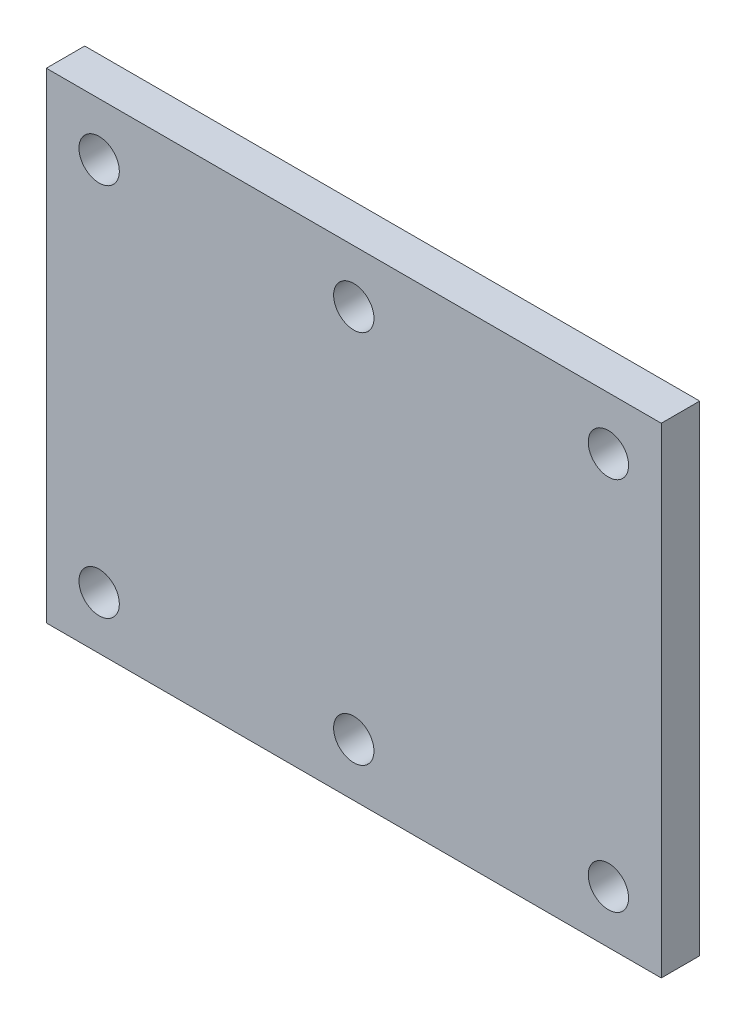
from build123d import *

# Parameters (mm, degrees)
SKETCH1_W           = 64
SKETCH1_H           = 50
SKETCH1_R           = 2.1
BOSS_EXTRUDE1_DEPTH = 4


with BuildPart() as part:
    # Sketch1 → Boss-Extrude1 (new body)
    with BuildSketch(Plane.XY):
        Rectangle(SKETCH1_W, SKETCH1_H)
        with Locations((-26.5, 19.5)):
            Circle(SKETCH1_R, mode=Mode.SUBTRACT)
        with Locations((26.5, 19.5)):
            Circle(SKETCH1_R, mode=Mode.SUBTRACT)
        with Locations((-26.5, -19.5)):
            Circle(SKETCH1_R, mode=Mode.SUBTRACT)
        with Locations((26.5, -19.5)):
            Circle(SKETCH1_R, mode=Mode.SUBTRACT)
        with Locations((0, 19.5)):
            Circle(SKETCH1_R, mode=Mode.SUBTRACT)
        with Locations((0, -19.5)):
            Circle(SKETCH1_R, mode=Mode.SUBTRACT)
    extrude(amount=BOSS_EXTRUDE1_DEPTH)


solid = part.part
